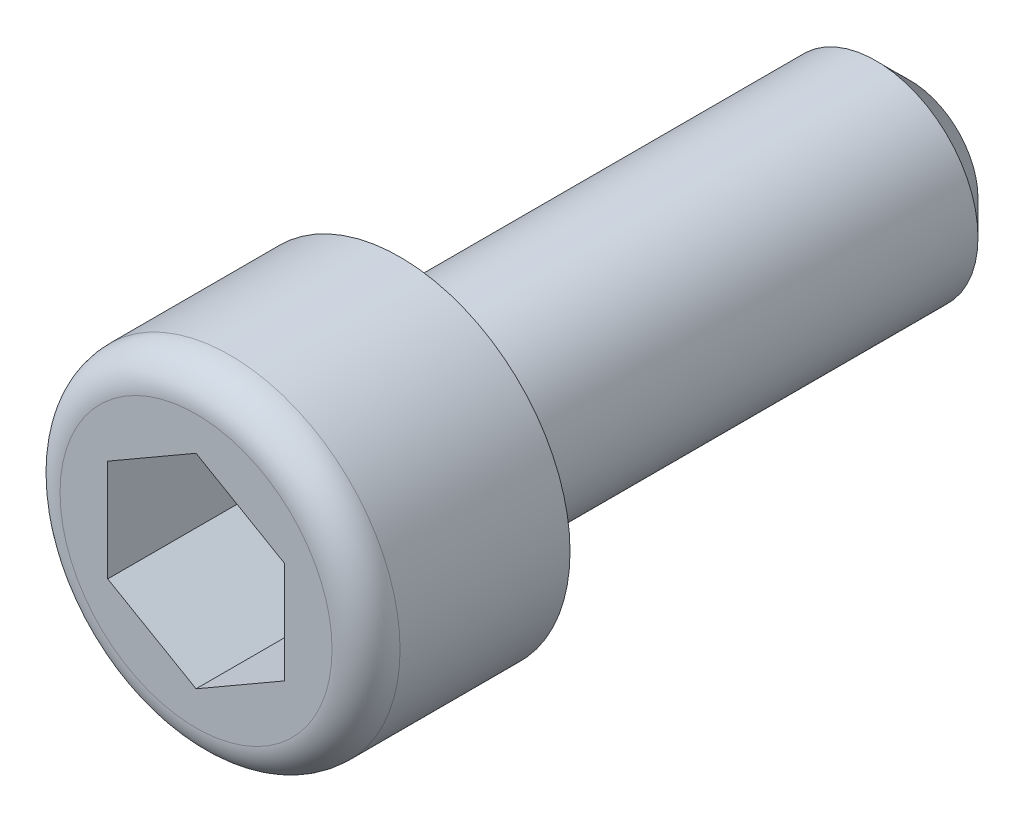
from build123d import *

# Parameters (mm, degrees)
FOOTPRINT_DEPTH = 4.5
CHAMFER1_SIZE   = 1
FILLET1_R       = 1


with BuildPart() as part:
    # Sketch1 → Body (revolve)
    with BuildSketch(Plane(origin=(0, 0, 0), x_dir=(0, 0, -1), z_dir=(1, 0, 0)), mode=Mode.PRIVATE) as body_sk:
        Polygon((0, 0), (0, 5), (6, 5), (6, 3), (21, 3), (21, 0), align=None)
    revolve(body_sk.sketch.rotate(Axis((0, 0, 156.291575099), (0, 0, -1)), 90), axis=Axis((0, 0, 156.291575099), (0, 0, -1)))

    # Sketch2 → Footprint (cut)
    with BuildSketch(Plane.XY):
        Polygon((0, 3), (-2.598076211, 1.5), (-2.598076211, -1.5), (0, -3), (2.598076211, -1.5), (2.598076211, 1.5), align=None)
    extrude(amount=-FOOTPRINT_DEPTH, mode=Mode.SUBTRACT)

    # Chamfer1
    chamfer1_edges = [part.edges().sort_by_distance(p)[0] for p in [
        (-3, 0, -21),
    ]]
    chamfer(chamfer1_edges, length=CHAMFER1_SIZE)

    # Fillet1
    fillet1_edges = [part.edges().sort_by_distance(p)[0] for p in [
        (-5, 0, 0),
    ]]
    fillet(fillet1_edges, radius=FILLET1_R)


solid = part.part
